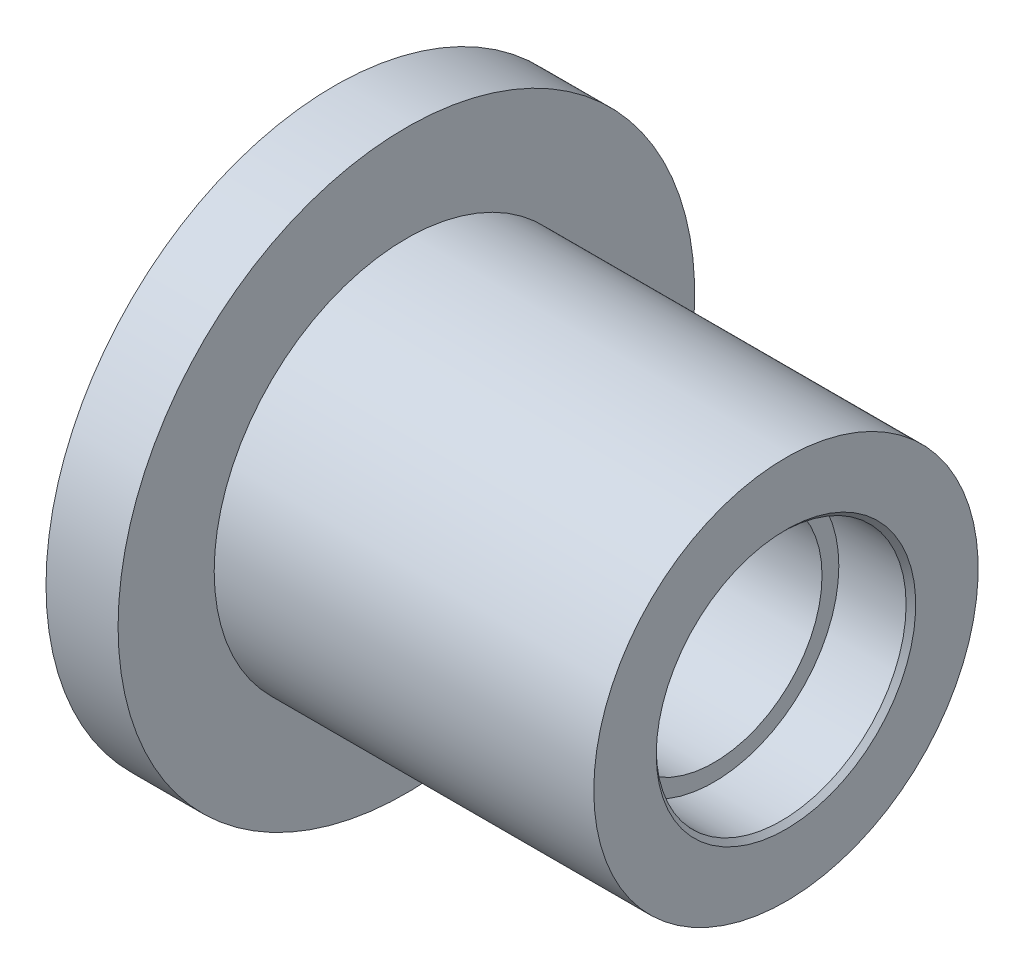
from build123d import *

# Parameters (mm, degrees)
SKETCH2_W                                           = 20
SKETCH2_H                                           = 24.98
CUT_EXTRUDE1_DEPTH                                  = 3
CBORE_FOR_M5_HEX_SOCKET_HEAD_CAP_SCREW1_D           = 45
CBORE_FOR_M5_HEX_SOCKET_HEAD_CAP_SCREW1_CBORE_D     = 52
CBORE_FOR_M5_HEX_SOCKET_HEAD_CAP_SCREW1_CBORE_DEPTH = 15
CHAMFER1_SIZE                                       = 1
CUT_EXTRUDE2_START                                  = -29
SKETCH15_R                                          = 26
CUT_EXTRUDE2_DEPTH                                  = 29
SKETCH16_W                                          = 2.15
SKETCH16_H                                          = 27.5


with BuildPart() as part:
    # Sketch1 → Revolve1 (revolve)
    with BuildSketch(Plane.XY, mode=Mode.PRIVATE) as revolve1_sk:
        Polygon((0, 0), (0, 40), (6, 40), (6, 60), (21, 60), (21, 40), (100, 40), (100, 0), align=None)
    revolve(revolve1_sk.sketch.rotate(Axis((0, 0, 0), (1, 0, 0)), 90), axis=Axis((0, 0, 0), (1, 0, 0)))

    # Sketch2 → Cut-Extrude1 (cut)
    with BuildSketch(Plane(origin=(0, 0, -40), x_dir=(-1, 0, 0), z_dir=(0, 0, -1))):
        with Locations((-60, 0)):
            Rectangle(SKETCH2_W, SKETCH2_H)
    extrude(amount=-CUT_EXTRUDE1_DEPTH, mode=Mode.SUBTRACT)

    # CBORE for M5 Hex Socket Head Cap Screw1 (through all)
    with Locations(Plane(origin=(100, 0, 0), x_dir=(0, 0, -1), z_dir=(1, 0, 0))):
        with Locations((0, 0)):
            CounterBoreHole(CBORE_FOR_M5_HEX_SOCKET_HEAD_CAP_SCREW1_D / 2, CBORE_FOR_M5_HEX_SOCKET_HEAD_CAP_SCREW1_CBORE_D / 2, CBORE_FOR_M5_HEX_SOCKET_HEAD_CAP_SCREW1_CBORE_DEPTH)

    # Chamfer1
    chamfer1_edges = [part.edges().sort_by_distance(p)[0] for p in [
        (100, 0, 26),
    ]]
    chamfer(chamfer1_edges, length=CHAMFER1_SIZE)

    # Sketch15 → Cut-Extrude2 (cut)
    with BuildSketch(Plane.ZY.offset(CUT_EXTRUDE2_START)):
        with Locations(Location((0, 0, 0), (0, 0, 180))):
            Circle(SKETCH15_R)
    extrude(amount=CUT_EXTRUDE2_DEPTH, mode=Mode.SUBTRACT)

    # Sketch16 → Cut-Revolve1 (revolve, cut)
    with BuildSketch(Plane.XY, mode=Mode.PRIVATE) as cut_revolve1_sk:
        with Locations((12.925, 13.75)):
            Rectangle(SKETCH16_W, SKETCH16_H)
    revolve(cut_revolve1_sk.sketch.rotate(Axis((0, 0, 0), (1, 0, 0)), 90), axis=Axis((0, 0, 0), (1, 0, 0)), mode=Mode.SUBTRACT)


solid = part.part
